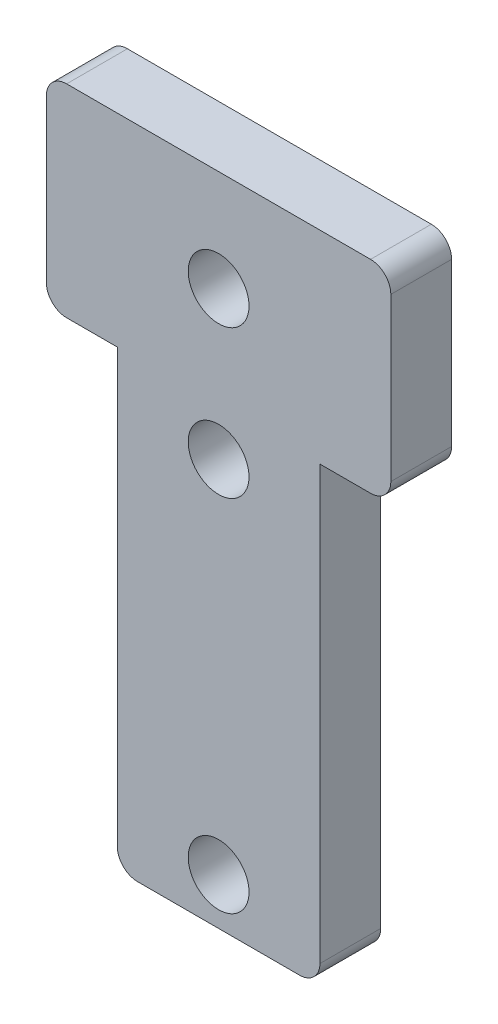
from build123d import *

# Parameters (mm, degrees)
SKETCH2_W           = 17
SKETCH2_H           = 10
SKETCH2_R           = 1.5
SKETCH2_W_2         = 10
SKETCH2_H_2         = 22.35
BOSS_EXTRUDE1_DEPTH = 3
FILLET5_R           = 1
FILLET6_R           = 1
FILLET7_R           = 1


with BuildPart() as part:
    # Sketch2 → Boss-Extrude1 (new body)
    # profile 1 of 2: a face of its own
    with BuildSketch(Plane.XY):
        Rectangle(SKETCH2_W, SKETCH2_H)
        Circle(SKETCH2_R, mode=Mode.SUBTRACT)
    # profile 2 of 2: a face of its own
    with BuildSketch(Plane.XY):
        with Locations((0, -16.175)):
            Rectangle(SKETCH2_W_2, SKETCH2_H_2)
        with Locations((0, -7.3)):
            Circle(SKETCH2_R, mode=Mode.SUBTRACT)
        with Locations((0, -25.05)):
            Circle(SKETCH2_R, mode=Mode.SUBTRACT)
    extrude(amount=BOSS_EXTRUDE1_DEPTH)

    # Fillet5
    fillet5_edges = [part.edges().sort_by_distance(p)[0] for p in [
        (8.5, -5, 1.5),
    ]]
    fillet(fillet5_edges, radius=FILLET5_R)

    # Fillet6
    fillet6_edges = [part.edges().sort_by_distance(p)[0] for p in [
        (5, -27.35, 1.5),
        (-5, -27.35, 1.5),
        (-8.5, -5, 1.5),
    ]]
    fillet(fillet6_edges, radius=FILLET6_R)

    # Fillet7
    fillet7_edges = [part.edges().sort_by_distance(p)[0] for p in [
        (8.5, 5, 1.5),
        (-8.5, 5, 1.5),
    ]]
    fillet(fillet7_edges, radius=FILLET7_R)


solid = part.part
